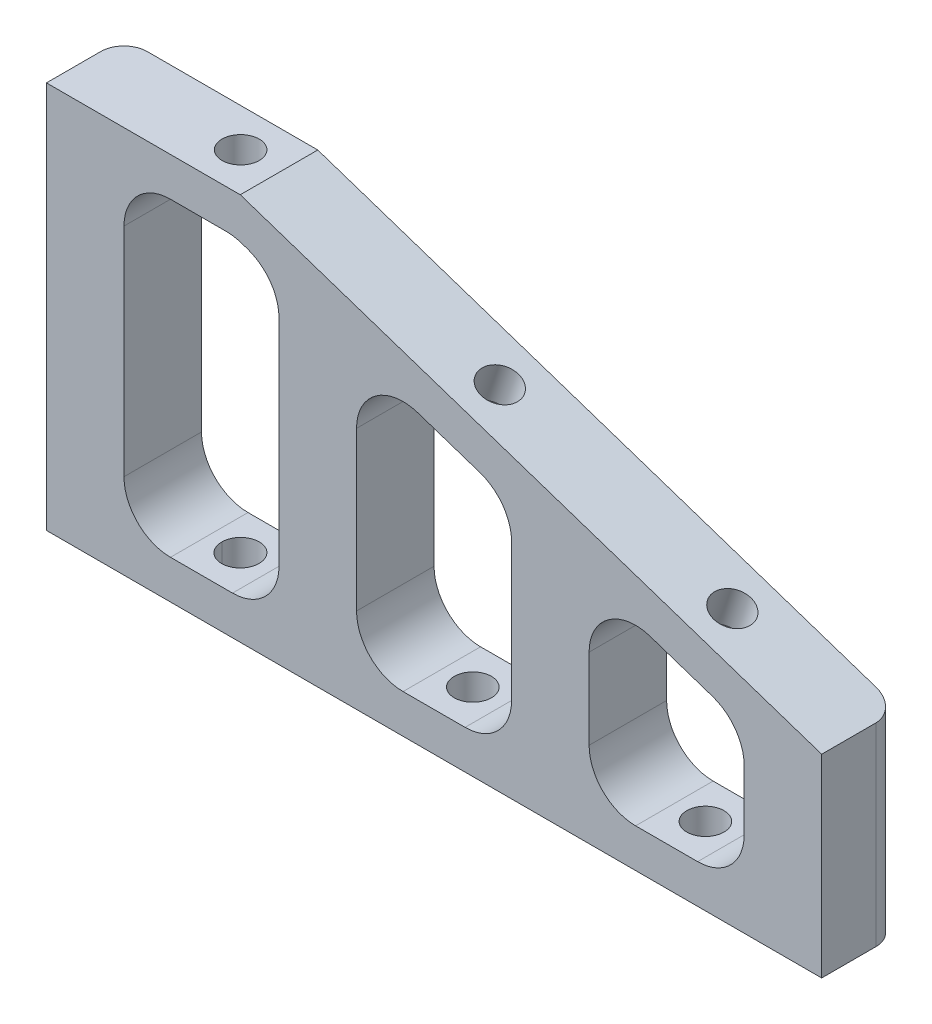
from build123d import *

# Parameters (mm, degrees)
BOSS_EXTRU_1_DEPTH      = 10
CONG_1_R                = 6
ESQUISSE3_R             = 2.4
ENL_V_MAT_EXTRU_1_DEPTH = 10
ESQUISSE4_R             = 2.4
ENL_V_MAT_EXTRU_2_DEPTH = 10
ESQUISSE5_R             = 2.4
ENL_V_MAT_EXTRU_3_DEPTH = 113.249721603
CONG_2_R                = 3


with BuildPart() as part:
    # Esquisse1 → Boss.-Extru.1 (new body)
    with BuildSketch(Plane.XY):
        Polygon((25, 50), (9.188611699, 50), (24.188611699, 45), (25, 45), align=None)
        Polygon((40, 45), (25, 50), (25, 45), (30, 45), (30, 43.062870566), (40, 39.729537233), align=None)
        Polygon((25, 45), (25, 44.729537233), (30, 43.062870566), (30, 45), align=None)
        Polygon((24.188611699, 45), (25, 44.729537233), (25, 45), align=None)
        Polygon((0, 50), (0, 25), (10, 25), (10, 45), (24.188611699, 45), (9.188611699, 50), align=None)
        Polygon((0, 25), (0, 0), (25, 0), (25, 5), (10, 5), (10, 25), align=None)
        Polygon((25, 5), (25, 0), (100, 0), (100, 19.729537233), (90, 23.062870566), (90, 5), (70, 5), (70, 25), (60, 25), (60, 5), (40, 5), (40, 25), (30, 25), (30, 5), align=None)
        Polygon((30, 43.062870566), (30, 25), (40, 25), (40, 39.729537233), align=None)
        Polygon((60, 38.333333333), (40, 45), (40, 39.729537233), (60, 33.062870566), align=None)
        Polygon((70, 29.729537233), (70, 35), (60, 38.333333333), (60, 33.062870566), align=None)
        Polygon((60, 25), (70, 25), (70, 29.729537233), (60, 33.062870566), align=None)
        Polygon((84.188611699, 25), (90, 25), (90, 28.333333333), (70, 35), (70, 29.729537233), align=None)
        Polygon((90, 25), (100, 25), (90, 28.333333333), align=None)
        Polygon((90, 23.062870566), (100, 19.729537233), (100, 25), (90, 25), align=None)
        Polygon((84.188611699, 25), (90, 23.062870566), (90, 25), align=None)
    extrude(amount=BOSS_EXTRU_1_DEPTH)

    # Congé1
    cong_1_edges = [part.edges().sort_by_distance(p)[0] for p in [
        (40, 39.729537233, 5),
        (40, 5, 5),
        (60, 5, 5),
        (60, 33.062870566, 5),
        (30, 43.062870566, 5),
        (24.188611699, 45, 5),
        (10, 45, 5),
        (10, 5, 5),
        (30, 5, 5),
        (70, 29.729537233, 5),
        (70, 5, 5),
        (90, 5, 5),
        (90, 23.062870566, 5),
    ]]
    fillet(cong_1_edges, radius=CONG_1_R)

    # Esquisse3 → Enlèv. mat.-Extru.1 (cut)
    with BuildSketch(Plane(origin=(15.91886117, 47.75658351, 0), x_dir=(0.9486832980505138, -0.31622776601683805, 0), z_dir=(-0.31622776601683805, -0.9486832980505138, 0))):
        with Locations((37.924674652, 5)):
            Circle(ESQUISSE3_R)
        with Locations((69.547451254, 5)):
            Circle(ESQUISSE3_R)
    extrude(amount=-ENL_V_MAT_EXTRU_1_DEPTH, mode=Mode.SUBTRACT)

    # Esquisse4 → Enlèv. mat.-Extru.2 (cut)
    with BuildSketch(Plane.XZ):
        with Locations(Location((20, 5, 0), (0, 0, 270))):
            Circle(ESQUISSE4_R)
        with Locations(Location((50, 5, 0), (0, 0, 270))):
            Circle(ESQUISSE4_R)
        with Locations(Location((80, 5, 0), (0, 0, 270))):
            Circle(ESQUISSE4_R)
    extrude(amount=-ENL_V_MAT_EXTRU_2_DEPTH, mode=Mode.SUBTRACT)

    # Esquisse5 → Enlèv. mat.-Extru.3 (cut, through all)
    with BuildSketch(Plane(origin=(0, 50, 0), x_dir=(1, 0, 0), z_dir=(0, 1, 0))):
        with Locations(Location((20, -4.950719268, 0), (0, 0, 270))):
            Circle(ESQUISSE5_R)
    extrude(amount=-ENL_V_MAT_EXTRU_3_DEPTH, mode=Mode.SUBTRACT)

    # Congé2
    cong_2_edges = [part.edges().sort_by_distance(p)[0] for p in [
        (0, 25, 0),
        (100, 12.5, 0),
    ]]
    fillet(cong_2_edges, radius=CONG_2_R)


solid = part.part
